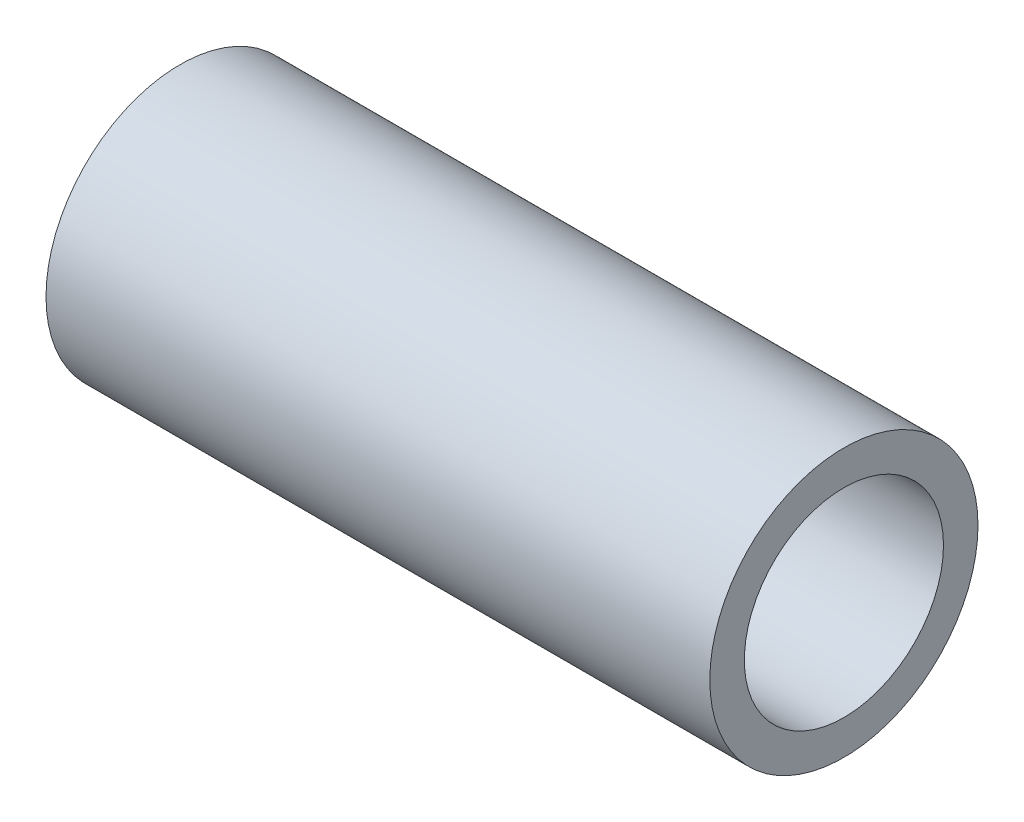
from build123d import *

# Parameters (mm, degrees)
SKETCH1_R           = 10.1
SKETCH1_R_2         = 7.5
BOSS_EXTRUDE1_DEPTH = 50


with BuildPart() as part:
    # Sketch1 → Boss-Extrude1 (new body)
    with BuildSketch(Plane(origin=(0, 0, 0), x_dir=(0, 0, -1), z_dir=(1, 0, 0))):
        Circle(SKETCH1_R)
        Circle(SKETCH1_R_2, mode=Mode.SUBTRACT)
    extrude(amount=BOSS_EXTRUDE1_DEPTH)


solid = part.part
